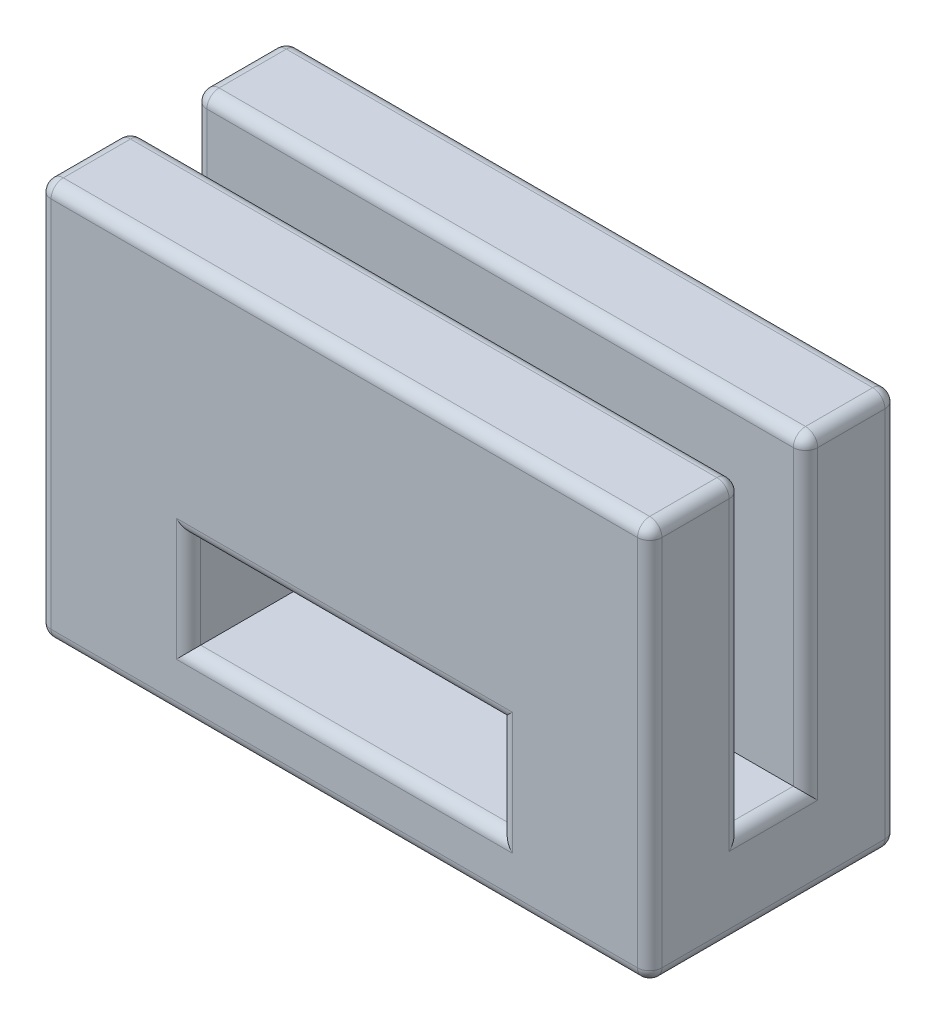
from build123d import *

# Parameters (mm, degrees)
SKETCH1_W           = 20
SKETCH1_H           = 8.1
BOSS_EXTRUDE1_DEPTH = 3
SKETCH2_W           = 20
SKETCH2_H           = 3
BOSS_EXTRUDE2_DEPTH = 10
SKETCH3_W           = 10.2
SKETCH3_H           = 3.2
CUT_EXTRUDE1_DEPTH  = 26.191466809
FILLET1_R           = 0.4


with BuildPart() as part:
    # Sketch1 → Boss-Extrude1 (new body)
    with BuildSketch(Plane(origin=(0, 0, 0), x_dir=(1, 0, 0), z_dir=(0, 1, 0))):
        with Locations((10, -4.05)):
            Rectangle(SKETCH1_W, SKETCH1_H)
    extrude(amount=BOSS_EXTRUDE1_DEPTH)

    # Sketch2 → Boss-Extrude2 (add)
    with BuildSketch(Plane(origin=(0, 3, 0), x_dir=(1, 0, 0), z_dir=(0, 1, 0))):
        with Locations((10, -1.5)):
            Rectangle(SKETCH2_W, SKETCH2_H)
        with Locations((10, -6.6)):
            Rectangle(SKETCH2_W, SKETCH2_H)
    extrude(amount=BOSS_EXTRUDE2_DEPTH)

    # Sketch3 → Cut-Extrude1 (cut, through all)
    with BuildSketch(Plane(origin=(0, 0, 0), x_dir=(-1, 0, 0), z_dir=(0, 0, -1))):
        with Locations((-10, 3.6)):
            Rectangle(SKETCH3_W, SKETCH3_H)
    extrude(amount=-CUT_EXTRUDE1_DEPTH, mode=Mode.SUBTRACT)

    # Fillet1
    fillet1_edges = [part.edges().sort_by_distance(p)[0] for p in [
        (0, 3, 4.05),
        (0, 8, 3),
        (20, 8, 3),
        (0, 13, 1.5),
        (10, 13, 3),
        (20, 13, 1.5),
        (10, 13, 0),
        (20, 3, 4.05),
        (0, 8, 5.1),
        (20, 8, 5.1),
        (0, 13, 6.6),
        (10, 13, 8.1),
        (20, 13, 6.6),
        (10, 13, 5.1),
        (15.1, 3.6, 8.1),
        (10, 5.2, 8.1),
        (4.9, 3.6, 8.1),
        (10, 2, 8.1),
        (15.1, 3.6, 0),
        (10, 2, 0),
        (4.9, 3.6, 0),
        (10, 0, 0),
        (10, 5.2, 0),
        (20, 0, 4.05),
        (10, 0, 8.1),
        (0, 0, 4.05),
        (0, 6.5, 0),
        (20, 6.5, 0),
        (20, 6.5, 8.1),
        (0, 6.5, 8.1),
    ]]
    fillet(fillet1_edges, radius=FILLET1_R)


solid = part.part
